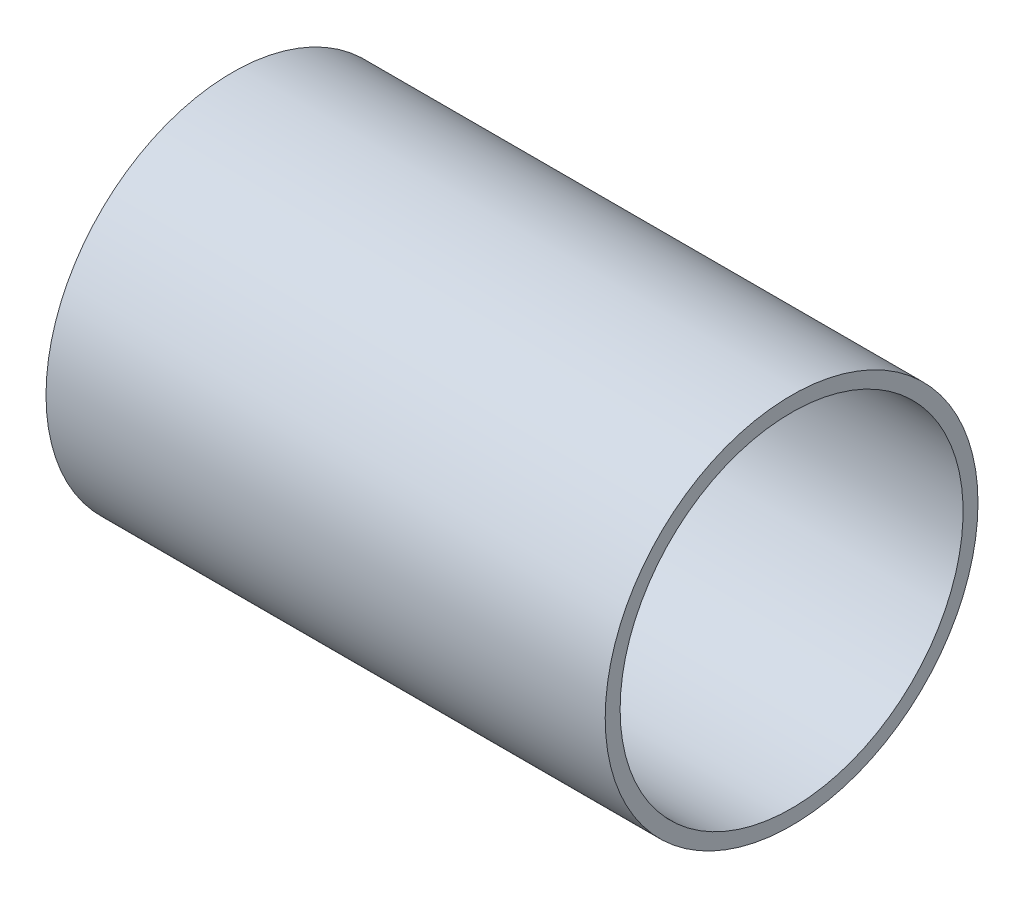
from build123d import *

# Parameters (mm, degrees)
SKETCH1_R           = 15
SKETCH1_R_2         = 13.8
BOSS_EXTRUDE1_DEPTH = 45


with BuildPart() as part:
    # Sketch1 → Boss-Extrude1 (new body)
    with BuildSketch(Plane(origin=(0, 0, 0), x_dir=(0, 0, -1), z_dir=(1, 0, 0))):
        with Locations(Location((0, 0, 0), (0, 0, 180))):
            Circle(SKETCH1_R)
        with Locations(Location((0, 0, 0), (0, 0, 180))):
            Circle(SKETCH1_R_2, mode=Mode.SUBTRACT)
    extrude(amount=BOSS_EXTRUDE1_DEPTH)


solid = part.part
